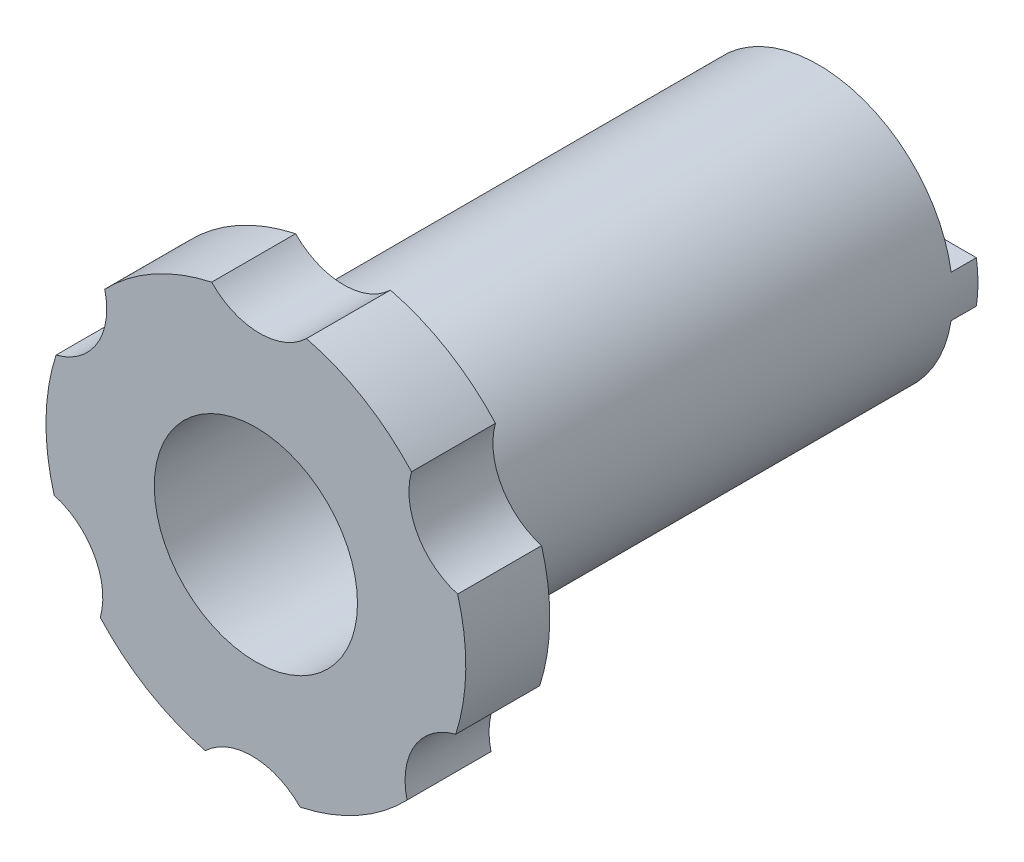
from build123d import *

# Parameters (mm, degrees)
SKETCH1_R               = 8
SKETCH1_R_2             = 6.05
BOSS_EXTRUDE1_DEPTH     = 30
CUT_EXTRUDE1_DEPTH      = 33.062439084
CUT_EXTRUDE1_DEPTH_BACK = 33.062439084
SKETCH2_W               = 6.75
SKETCH2_H               = 1.5
SKETCH3_R               = 12.5
SKETCH3_R_2             = 6.05
BOSS_EXTRUDE2_DEPTH     = 5
CUT_EXTRUDE2_DEPTH      = 40.210967853
CUT_EXTRUDE2_DEPTH_BACK = 40.210967853
SKETCH4_R               = 4


with BuildPart() as part:
    # Sketch1 → Boss-Extrude1 (new body)
    with BuildSketch(Plane(origin=(0, 0, 0), x_dir=(0, 1, 0), z_dir=(0, 0, 1))):
        with Locations(Location((0, 0, 0), (0, 0, 270))):
            Circle(SKETCH1_R)
        with Locations(Location((0, 0, 0), (0, 0, 270))):
            Circle(SKETCH1_R_2, mode=Mode.SUBTRACT)
    extrude(amount=BOSS_EXTRUDE1_DEPTH)

    # Sketch2 → Cut-Extrude1 (cut, two sides: drawn at the far end of the back side and taken through both)
    with BuildSketch(Plane.YZ.offset(-CUT_EXTRUDE1_DEPTH_BACK)):
        with Locations((-4.625, 0.75)):
            Rectangle(SKETCH2_W, SKETCH2_H)
        with Locations((4.625, 0.75)):
            Rectangle(SKETCH2_W, SKETCH2_H)
    extrude(amount=CUT_EXTRUDE1_DEPTH + CUT_EXTRUDE1_DEPTH_BACK, mode=Mode.SUBTRACT)

    # Sketch3 → Boss-Extrude2 (add)
    with BuildSketch(Plane.XY.offset(30)):
        Circle(SKETCH3_R)
        with Locations(Location((0, 0, 0), (0, 0, 168.076144872))):
            Circle(SKETCH3_R_2, mode=Mode.SUBTRACT)
    extrude(amount=BOSS_EXTRUDE2_DEPTH)

    # Sketch4 → Cut-Extrude2 (cut, two sides: drawn at the far end of the back side and taken through both)
    with BuildSketch(Plane.XY.offset(35).offset(-CUT_EXTRUDE2_DEPTH_BACK)):
        with Locations((-12.882183606, 7.706015759)):
            Circle(SKETCH4_R)
        with Locations((0.232513607, 15.009306138)):
            Circle(SKETCH4_R)
        with Locations((13.114697212, 7.303290379)):
            Circle(SKETCH4_R)
        with Locations((12.882183606, -7.706015759)):
            Circle(SKETCH4_R)
        with Locations((-0.232513607, -15.009306138)):
            Circle(SKETCH4_R)
        with Locations((-13.114697212, -7.303290379)):
            Circle(SKETCH4_R)
    extrude(amount=CUT_EXTRUDE2_DEPTH + CUT_EXTRUDE2_DEPTH_BACK, mode=Mode.SUBTRACT)


solid = part.part
